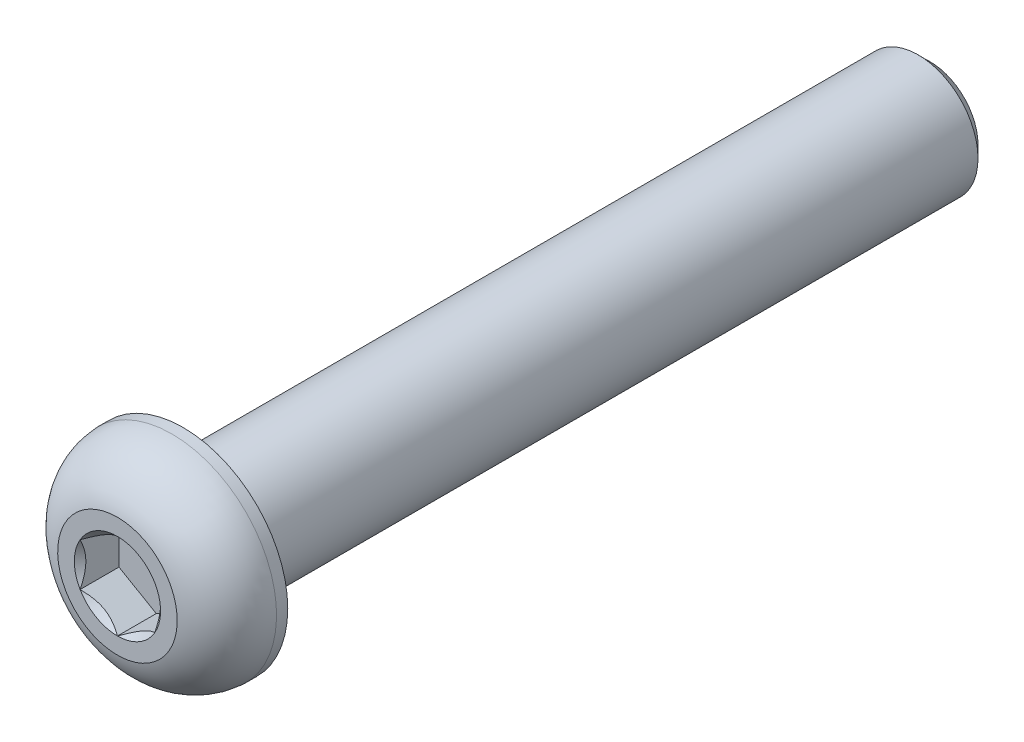
from build123d import *

# Parameters (mm, degrees)
BOSS_EXTRUDE1_START = -21.2
SKETCH1_R           = 4
BOSS_EXTRUDE1_DEPTH = 50
SKETCH2_R           = 7
BOSS_EXTRUDE2_DEPTH = 4.4
CUT_EXTRUDE1_DEPTH  = 2.6
SKETCH5_R           = 2.886751346
CUT_EXTRUDE2_DEPTH  = 1
CUT_EXTRUDE2_DRAFT  = -45
CHAMFER1_SIZE       = 0.8


with BuildPart() as part:
    # Sketch1 → Boss-Extrude1 (new body)
    with BuildSketch(Plane.XY.offset(BOSS_EXTRUDE1_START)):
        with Locations((-20, 0)):
            Circle(SKETCH1_R)
    extrude(amount=-BOSS_EXTRUDE1_DEPTH)

    # Sketch2 → Boss-Extrude2 (add)
    with BuildSketch(Plane.XY.offset(-21.2)):
        with Locations((-20, 0)):
            Circle(SKETCH2_R)
    extrude(amount=BOSS_EXTRUDE2_DEPTH)

    # Sketch3 → Cut-Revolve1 (revolve, cut)
    with BuildSketch(Plane(origin=(-20, 0, 0), x_dir=(0, 0, -1), z_dir=(1, 0, 0))):
        with BuildLine():
            Line((16.8, 4), (15.8, 4))
            Line((15.8, 4), (15.8, 8))
            Line((15.8, 8), (20.9, 8))
            Line((20.9, 8), (20.9, 7))
            ThreePointArc((20.9, 7), (18.312578573, 6.23447595), (16.8, 4))
        make_face()
    revolve(axis=Axis((-20, 0, -71.2), (0, 0, 1)), mode=Mode.SUBTRACT)

    # Sketch4 → Cut-Extrude1 (cut)
    with BuildSketch(Plane.XY.offset(-16.8)):
        Polygon((-20, 2.886751346), (-22.5, 1.443375673), (-22.5, -1.443375673), (-20, -2.886751346), (-17.5, -1.443375673), (-17.5, 1.443375673), align=None)
    extrude(amount=-CUT_EXTRUDE1_DEPTH, mode=Mode.SUBTRACT)


with BuildPart() as cut_extrude2_tool:
    # Sketch5 → Cut-Extrude2 (with draft: the straight prism first)
    with BuildSketch(Plane.XY.offset(-16.8)):
        with Locations((-20, 0)):
            Circle(SKETCH5_R)
    extrude(amount=-CUT_EXTRUDE2_DEPTH)
    # Cut-Extrude2: the draft: its side faces are tilted about the plane it starts from
    cut_extrude2_sides = [cut_extrude2_tool.faces().sort_by_distance(p)[0] for p in [
        (-22.886751346, 0, -17.3),
    ]]
    draft(cut_extrude2_sides, Plane.XY.offset(-16.8), CUT_EXTRUDE2_DRAFT)


with BuildPart() as part_1:
    add(part.part)

    # Cut-Extrude2: cut by cut_extrude2_tool
    add(cut_extrude2_tool.part, mode=Mode.SUBTRACT)

    # Chamfer1
    chamfer1_edges = [part_1.edges().sort_by_distance(p)[0] for p in [
        (-24, 0, -71.2),
    ]]
    chamfer(chamfer1_edges, length=CHAMFER1_SIZE)


solid = part_1.part
